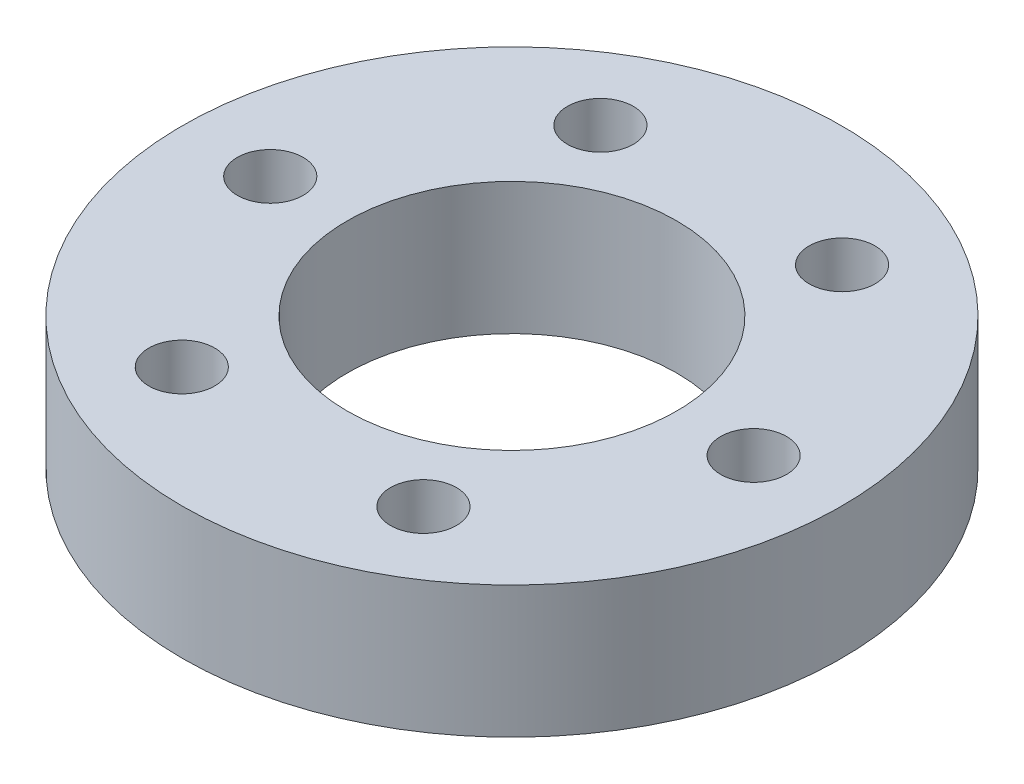
from build123d import *

# Parameters (mm, degrees)
SKETCH_1_R               = 30
EXTRUDE_1_DEPTH          = 12
SKETCH_2_R               = 15
CUT_EXTRUDE_1_DEPTH      = 12
SKETCH_3_R               = 3
CUT_EXTRUDE_2_DEPTH      = 12
PATTERN_CIRCULAR_1_COUNT = 6


with BuildPart() as part:
    # 草图1 → 凸台-拉伸1 (new body)
    with BuildSketch(Plane(origin=(0, 0, 0), x_dir=(1, 0, 0), z_dir=(0, 1, 0))):
        with Locations(Location((0, 0, 0), (0, 0, 270))):
            Circle(SKETCH_1_R)
    extrude(amount=EXTRUDE_1_DEPTH)

    # 草图2 → 切除-拉伸1 (cut)
    with BuildSketch(Plane(origin=(0, 0, 0), x_dir=(1, 0, 0), z_dir=(0, 1, 0))):
        with Locations(Location((0, 0, 0), (0, 0, 270))):
            Circle(SKETCH_2_R)
    extrude(amount=CUT_EXTRUDE_1_DEPTH, mode=Mode.SUBTRACT)

    # 草图3 → 切除-拉伸2 (cut)
    with BuildSketch(Plane(origin=(0, 0, 0), x_dir=(1, 0, 0), z_dir=(0, 1, 0))):
        with Locations(Location((22, 0, 0), (0, 0, 270))):
            Circle(SKETCH_3_R)
    cut_extrude_2 = extrude(amount=CUT_EXTRUDE_2_DEPTH, mode=Mode.SUBTRACT)

    # 阵列(圆周)1: 切除-拉伸2 ×6 about axis
    pattern_circular_1_axis = Axis((0, 0, 0), (0, 1, 0))
    for i in range(1, PATTERN_CIRCULAR_1_COUNT):
        add(cut_extrude_2.rotate(pattern_circular_1_axis, i * 360 / PATTERN_CIRCULAR_1_COUNT), mode=Mode.SUBTRACT)


solid = part.part
